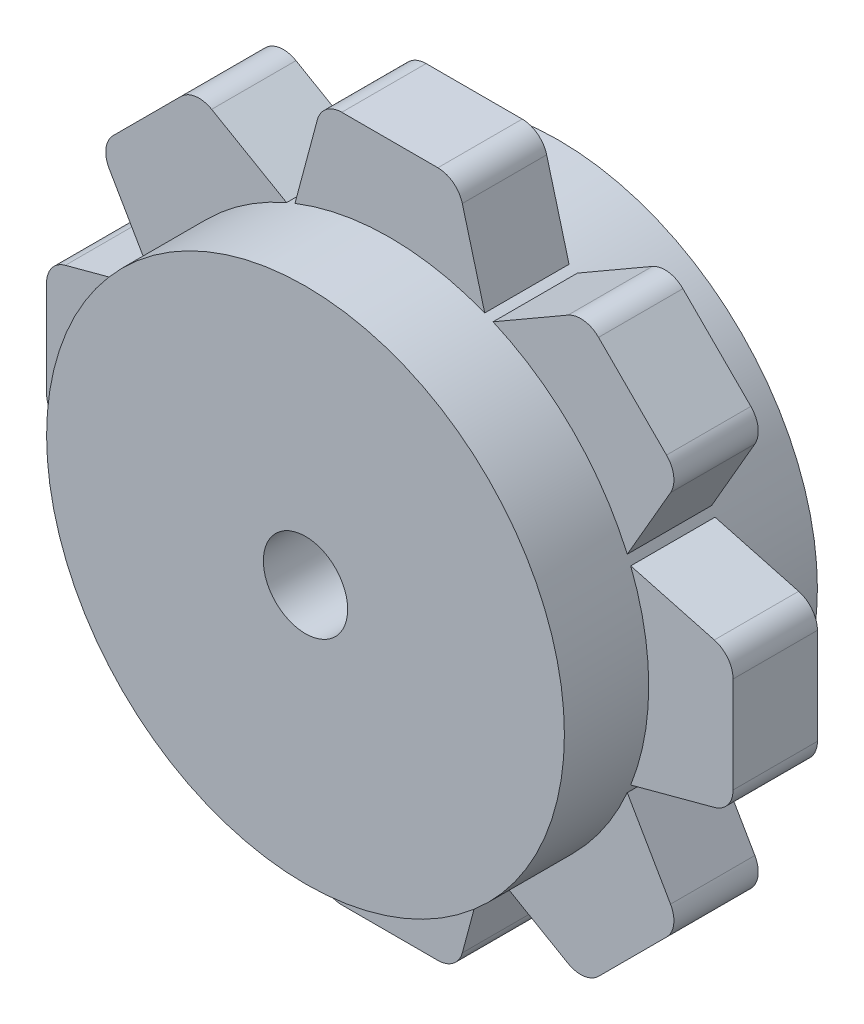
from build123d import *

# Parameters (mm, degrees)
SKETCH_1_R      = 15.35
SKETCH_1_R_2    = 2.5
EXTRUDE_1_DEPTH = 15
EXTRUDE_START   = 5
EXTRUDE_2_DEPTH = 5
FILLET_1_R      = 1.5


with BuildPart() as part:
    # 草图1 → 凸台-拉伸1 (new body)
    with BuildSketch(Plane.XY):
        Circle(SKETCH_1_R)
        Circle(SKETCH_1_R_2, mode=Mode.SUBTRACT)
    extrude(amount=EXTRUDE_1_DEPTH)

    # 草图1<3> → 凸台-拉伸2 (add)
    with BuildSketch(Plane.XY.offset(EXTRUDE_START)):
        with BuildLine():
            Line((-4, 20.35), (-5.625957141, 14.281845337))
            ThreePointArc((-5.625957141, 14.281845337), (0, 15.35), (5.625957141, 14.281845337))
            Line((5.625957141, 14.281845337), (4, 20.35))
            Line((4, 20.35), (-4, 20.35))
        make_face()
        with BuildLine():
            ThreePointArc((-14.076942131, 6.120637241), (-10.854089091, 10.854089091), (-6.120637241, 14.076942131))
            Line((-6.120637241, 14.076942131), (-11.561195872, 17.218050122))
            Line((-11.561195872, 17.218050122), (-17.218050122, 11.561195872))
            Line((-17.218050122, 11.561195872), (-14.076942131, 6.120637241))
        make_face()
        with BuildLine():
            ThreePointArc((-14.281845337, -5.625957141), (-15.35, 0), (-14.281845337, 5.625957141))
            Line((-14.281845337, 5.625957141), (-20.35, 4))
            Line((-20.35, 4), (-20.35, -4))
            Line((-20.35, -4), (-14.281845337, -5.625957141))
        make_face()
        with BuildLine():
            Line((11.561195872, 17.218050122), (6.120637241, 14.076942131))
            ThreePointArc((6.120637241, 14.076942131), (10.854089091, 10.854089091), (14.076942131, 6.120637241))
            Line((14.076942131, 6.120637241), (17.218050122, 11.561195872))
            Line((17.218050122, 11.561195872), (11.561195872, 17.218050122))
        make_face()
        with BuildLine():
            ThreePointArc((-6.120637241, -14.076942131), (-10.854089091, -10.854089091), (-14.076942131, -6.120637241))
            Line((-14.076942131, -6.120637241), (-17.218050122, -11.561195872))
            Line((-17.218050122, -11.561195872), (-11.561195872, -17.218050122))
            Line((-11.561195872, -17.218050122), (-6.120637241, -14.076942131))
        make_face()
        with BuildLine():
            Line((20.35, 4), (14.281845337, 5.625957141))
            ThreePointArc((14.281845337, 5.625957141), (15.35, 0), (14.281845337, -5.625957141))
            Line((14.281845337, -5.625957141), (20.35, -4))
            Line((20.35, -4), (20.35, 4))
        make_face()
        with BuildLine():
            ThreePointArc((5.625957141, -14.281845337), (0, -15.35), (-5.625957141, -14.281845337))
            Line((-5.625957141, -14.281845337), (-4, -20.35))
            Line((-4, -20.35), (4, -20.35))
            Line((4, -20.35), (5.625957141, -14.281845337))
        make_face()
        with BuildLine():
            Line((17.218050122, -11.561195872), (14.076942131, -6.120637241))
            ThreePointArc((14.076942131, -6.120637241), (10.854089091, -10.854089091), (6.120637241, -14.076942131))
            Line((6.120637241, -14.076942131), (11.561195872, -17.218050122))
            Line((11.561195872, -17.218050122), (17.218050122, -11.561195872))
        make_face()
    extrude(amount=EXTRUDE_2_DEPTH)

    # 圆角1
    fillet_1_edges = [part.edges().sort_by_distance(p)[0] for p in [
        (-11.561195872, 17.218050122, 7.5),
        (-17.218050122, 11.561195872, 7.5),
        (-20.35, 4, 7.5),
        (-20.35, -4, 7.5),
        (-17.218050122, -11.561195872, 7.5),
        (-11.561195872, -17.218050122, 7.5),
        (-4, -20.35, 7.5),
        (4, -20.35, 7.5),
        (11.561195872, -17.218050122, 7.5),
        (17.218050122, -11.561195872, 7.5),
        (20.35, -4, 7.5),
        (20.35, 4, 7.5),
        (17.218050122, 11.561195872, 7.5),
        (11.561195872, 17.218050122, 7.5),
        (4, 20.35, 7.5),
        (-4, 20.35, 7.5),
    ]]
    fillet(fillet_1_edges, radius=FILLET_1_R)


solid = part.part
